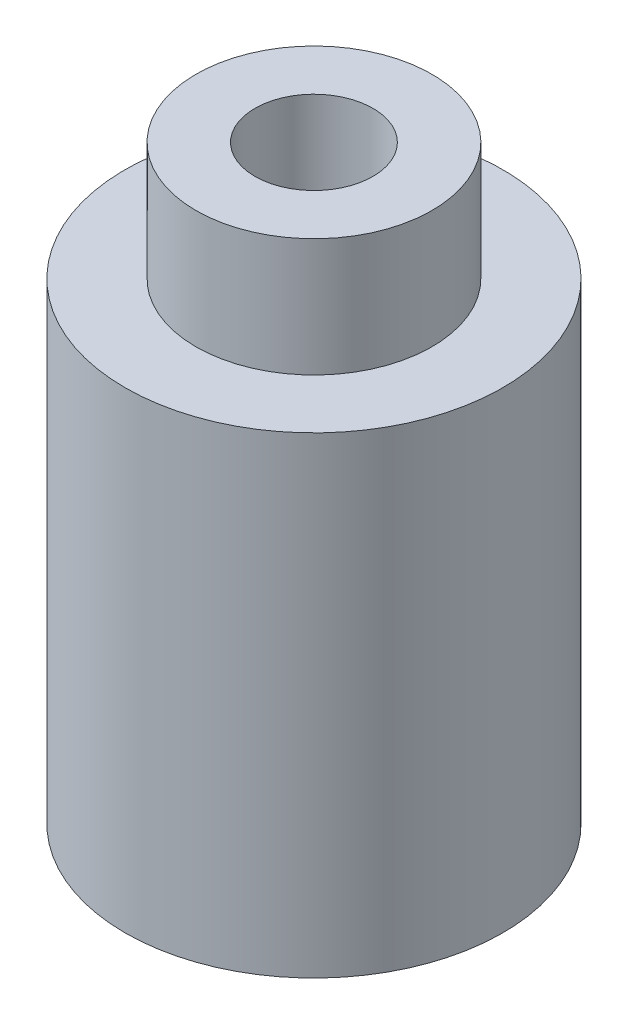
from build123d import *


with BuildPart() as part:
    # Sketch1 → Revolve1 (revolve)
    with BuildSketch(Plane(origin=(0, 0, 0), x_dir=(0, 0, -1), z_dir=(1, 0, 0)), mode=Mode.PRIVATE) as revolve1_sk:
        Polygon((1693.448007135, 1523.425221362), (1690.448007135, 1523.425221362), (1690.448007135, 1542.062525116), (1687.948007135, 1542.062525116), (1687.948007135, 1548.425221362), (1690.448007135, 1548.425221362), (1690.448007135, 1543.425221362), (1693.448007135, 1543.425221362), align=None)
    revolve(revolve1_sk.sketch.rotate(Axis((0, 1543.425221362, -1685.448007135), (0, -1, 0)), 180), axis=Axis((0, 1543.425221362, -1685.448007135), (0, -1, 0)))


solid = part.part
